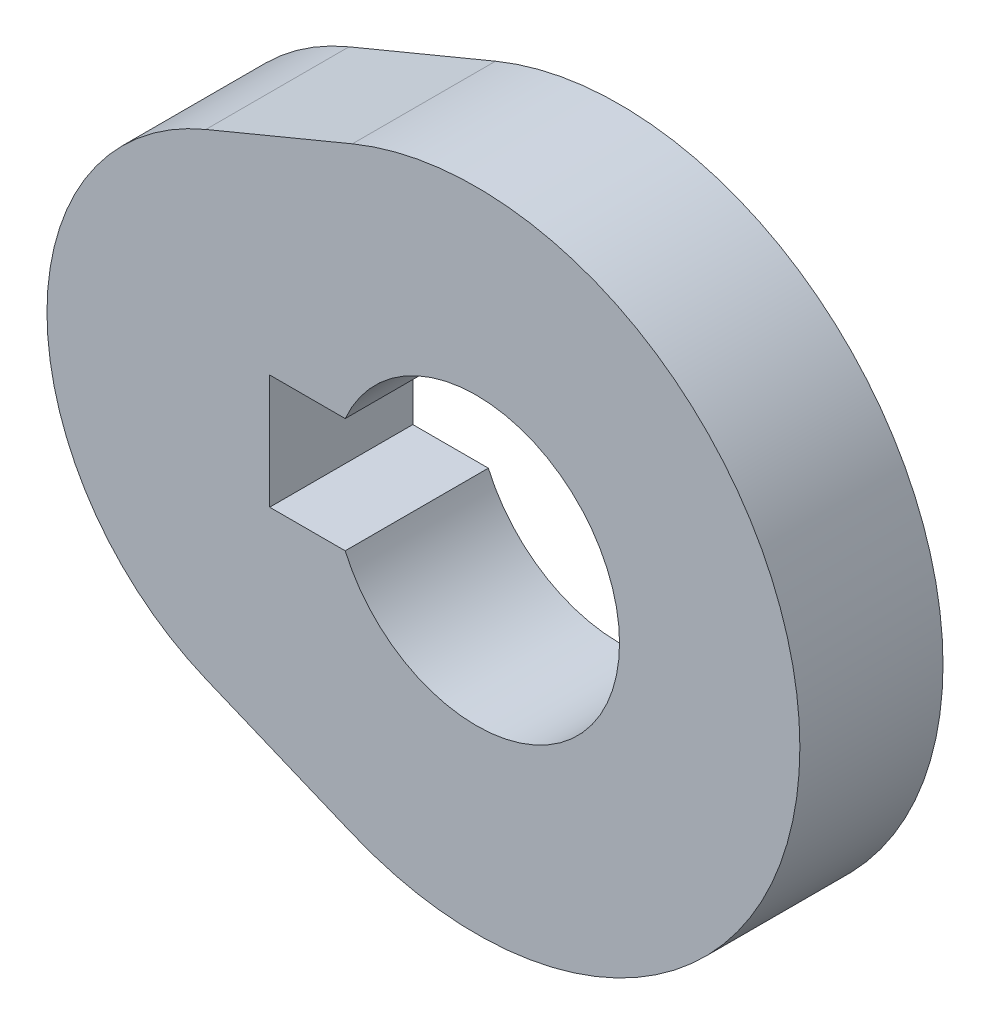
from build123d import *

# Parameters (mm, degrees)
BOSS_EXTRUDE2_DEPTH = 5


with BuildPart() as part:
    # Sketch3 → Boss-Extrude2 (new body)
    with BuildSketch(Plane.XY):
        with BuildLine():
            ThreePointArc((-20.75, 8.312490601), (-26.3, 0), (-20.75, -8.312490601))
            Line((-20.75, -8.312490601), (-15.631666667, -10.436793755))
            ThreePointArc((-15.631666667, -10.436793755), (0, 0), (-15.631666667, 10.436793755))
            Line((-15.631666667, 10.436793755), (-20.75, 8.312490601))
        make_face()
        with BuildLine():
            Line((-15.882575695, -2), (-18.52, -2))
            Line((-18.52, -2), (-18.52, 2))
            Line((-18.52, 2), (-15.882575695, 2))
            ThreePointArc((-15.882575695, 2), (-6.3, 0), (-15.882575695, -2))
        make_face(mode=Mode.SUBTRACT)
    extrude(amount=BOSS_EXTRUDE2_DEPTH)


solid = part.part
